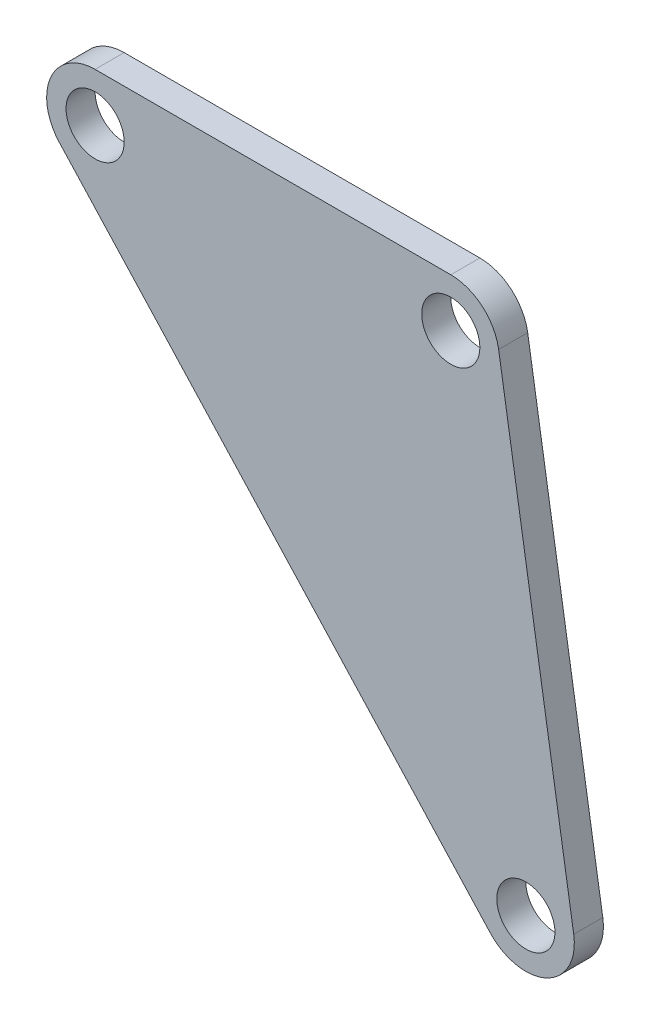
from build123d import *

# Parameters (mm, degrees)
SKETCH_1_R      = 3
EXTRUDE_1_DEPTH = 3
FILLET_1_R      = 5


with BuildPart() as part:
    # ｽｹｯﾁ1 → ﾎﾞｽ - 押し出し1 (new body)
    with BuildSketch(Plane.XY):
        Polygon((-48.082594675, 5), (15.312222711, -64.010484178), (4.263144073, 5), align=None)
        with Locations((-36.7, 0)):
            Circle(SKETCH_1_R, mode=Mode.SUBTRACT)
        Circle(SKETCH_1_R, mode=Mode.SUBTRACT)
        with Locations((7.746594005, -48.38378118)):
            Circle(SKETCH_1_R, mode=Mode.SUBTRACT)
    extrude(amount=EXTRUDE_1_DEPTH)

    # ﾌｨﾚｯﾄ1
    fillet_1_edges = [part.edges().sort_by_distance(p)[0] for p in [
        (4.263144073, 5, 1.5),
        (15.312222711, -64.010484178, 1.5),
        (-48.082594675, 5, 1.5),
    ]]
    fillet(fillet_1_edges, radius=FILLET_1_R)


solid = part.part
